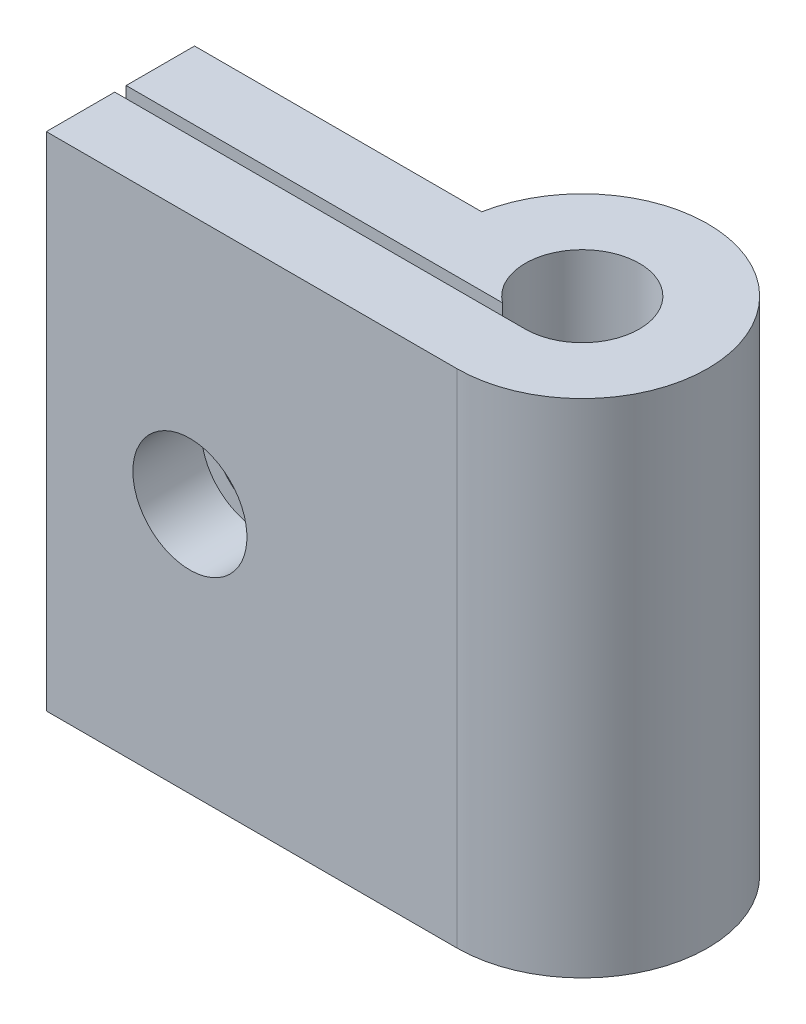
from build123d import *

# Parameters (mm, degrees)
SALIENTE_EXTRUIR1_DEPTH = 22
CROQUIS2_R              = 2.5
CORTAR_EXTRUIR1_DEPTH   = 15


with BuildPart() as part:
    # Croquis1 → Saliente-Extruir1 (new body)
    with BuildSketch(Plane(origin=(0, 0, 0), x_dir=(1, 0, 0), z_dir=(0, 1, 0))):
        with BuildLine():
            Line((0, -5.5), (-18, -5.5))
            Line((-18, -5.5), (-18, -2.5))
            Line((-18, -2.5), (-7.399590065, -2.5))
            Line((-7.399590065, -2.5), (0, -2.5))
            ThreePointArc((0, -2.5), (0.790569415, 2.371708245), (-1.5, -2))
            Line((-1.5, -2), (-6.46658194, -2))
            Line((-6.46658194, -2), (-18, -2))
            Line((-18, -2), (-18, 1))
            Line((-18, 1), (-5.408326913, 1))
            ThreePointArc((-5.408326913, 1), (4.227883631, 3.51781182), (0, -5.5))
        make_face()
    extrude(amount=SALIENTE_EXTRUIR1_DEPTH)

    # Croquis2 → Cortar-Extruir1 (cut)
    with BuildSketch(Plane(origin=(0, 0, -1), x_dir=(-1, 0, 0), z_dir=(0, 0, -1))):
        with Locations((11.704163457, 11)):
            Circle(CROQUIS2_R)
    extrude(amount=-CORTAR_EXTRUIR1_DEPTH, mode=Mode.SUBTRACT)


solid = part.part
